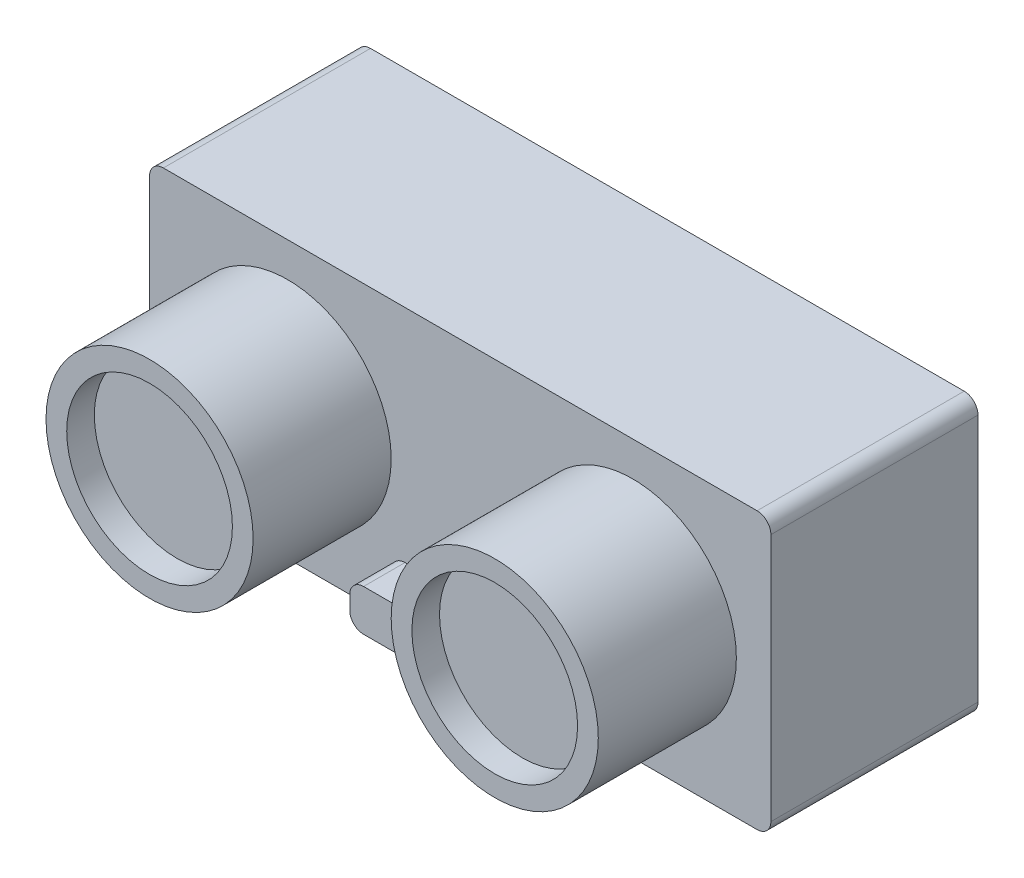
from build123d import *

# Parameters (mm, degrees)
BOSS_EXTRUDE1_DEPTH = 15
SKETCH2_R           = 7.5
BOSS_EXTRUDE2_DEPTH = 10
SKETCH3_R           = 6
CUT_EXTRUDE1_DEPTH  = 2
BOSS_EXTRUDE3_DEPTH = 3


with BuildPart() as part:
    # Sketch1 → Boss-Extrude1 (new body)
    with BuildSketch(Plane.XY):
        with BuildLine():
            Line((1, 0), (44, 0))
            ThreePointArc((44, 0), (44.707106781, 0.292893219), (45, 1))
            Line((45, 1), (45, 19))
            ThreePointArc((45, 19), (44.707106781, 19.707106781), (44, 20))
            Line((44, 20), (1, 20))
            ThreePointArc((1, 20), (0.292893219, 19.707106781), (0, 19))
            Line((0, 19), (0, 1))
            ThreePointArc((0, 1), (0.292893219, 0.292893219), (1, 0))
        make_face()
    extrude(amount=BOSS_EXTRUDE1_DEPTH)

    # Sketch2 → Boss-Extrude2 (add)
    with BuildSketch(Plane.XY.offset(15)):
        with Locations(Location((10, 10, 0), (0, 0, 180))):
            Circle(SKETCH2_R)
        with Locations(Location((35, 10, 0), (0, 0, 180))):
            Circle(SKETCH2_R)
    extrude(amount=BOSS_EXTRUDE2_DEPTH)

    # Sketch3 → Cut-Extrude1 (cut)
    with BuildSketch(Plane.XY.offset(25)):
        with Locations((10, 10)):
            Circle(SKETCH3_R)
        with Locations((35, 10)):
            Circle(SKETCH3_R)
    extrude(amount=-CUT_EXTRUDE1_DEPTH, mode=Mode.SUBTRACT)

    # Sketch4 → Boss-Extrude3 (add)
    with BuildSketch(Plane.XY.offset(15)):
        with BuildLine():
            Line((18.5, 4), (26.5, 4))
            ThreePointArc((26.5, 4), (27.207106781, 3.707106781), (27.5, 3))
            Line((27.5, 3), (27.5, 2))
            ThreePointArc((27.5, 2), (27.207106781, 1.292893219), (26.5, 1))
            Line((26.5, 1), (18.5, 1))
            ThreePointArc((18.5, 1), (17.792893219, 1.292893219), (17.5, 2))
            Line((17.5, 2), (17.5, 3))
            ThreePointArc((17.5, 3), (17.792893219, 3.707106781), (18.5, 4))
        make_face()
    extrude(amount=BOSS_EXTRUDE3_DEPTH)


solid = part.part
